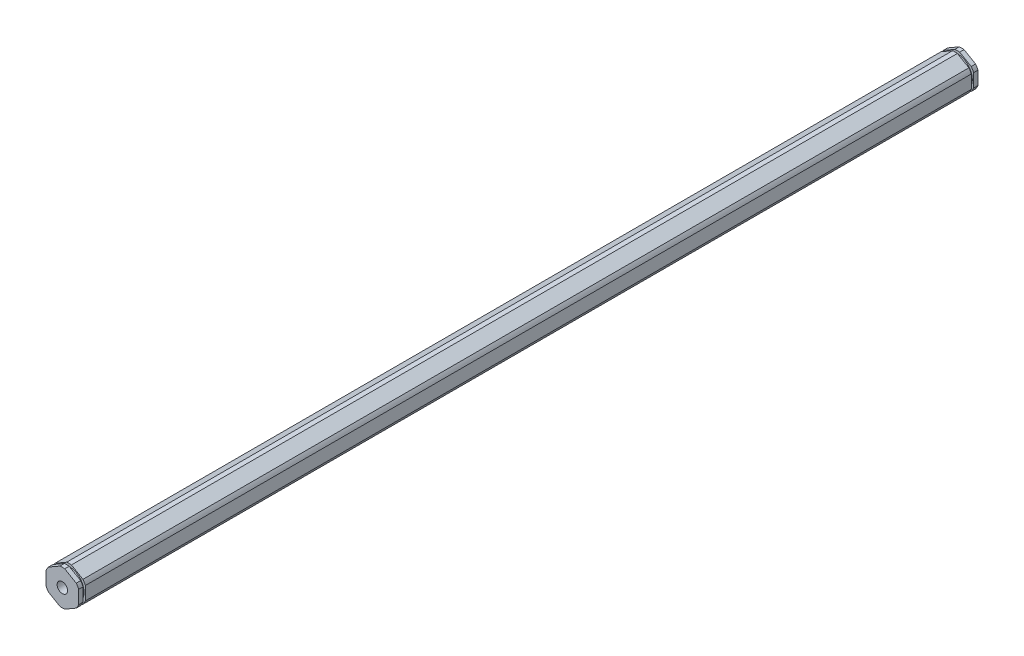
from build123d import *

# Parameters (mm, degrees)
BOSS_EXTRUDE1_DEPTH                  = 174.84725
F_10_32_TAPPED_HOLE1_D               = 4.0386
F_10_32_TAPPED_HOLE1_DEPTH           = 16.34744
F_10_32_TAPPED_HOLE1_TIP             = 1.213317848
F_10_32_TAPPED_HOLE1_ON_FACE_2_D     = 4.0386
F_10_32_TAPPED_HOLE1_ON_FACE_2_DEPTH = 16.34744
F_10_32_TAPPED_HOLE1_ON_FACE_2_TIP   = 1.213317848
SKETCH3_W                            = 0.889
SKETCH3_H                            = 1.0033


with BuildPart() as part:
    # Sketch1 → Boss-Extrude1 (new, symmetric)
    with BuildSketch(Plane.XY):
        with BuildLine():
            ThreePointArc((0.93173274, 6.79441227), (0, 6.858), (-0.93173274, 6.79441227))
            Line((-0.93173274, 6.79441227), (-5.41826726, 4.204110358))
            ThreePointArc((-5.41826726, 4.204110358), (-5.939202219, 3.429), (-6.35, 2.590301913))
            Line((-6.35, 2.590301913), (-6.35, -2.590301913))
            ThreePointArc((-6.35, -2.590301913), (-5.939202219, -3.429), (-5.41826726, -4.204110358))
            Line((-5.41826726, -4.204110358), (-0.93173274, -6.79441227))
            ThreePointArc((-0.93173274, -6.79441227), (0, -6.858), (0.93173274, -6.79441227))
            Line((0.93173274, -6.79441227), (5.41826726, -4.204110358))
            ThreePointArc((5.41826726, -4.204110358), (5.939202219, -3.429), (6.35, -2.590301913))
            Line((6.35, -2.590301913), (6.35, 2.590301913))
            ThreePointArc((6.35, 2.590301913), (5.939202219, 3.429), (5.41826726, 4.204110358))
            Line((5.41826726, 4.204110358), (0.93173274, 6.79441227))
        make_face()
    extrude(amount=BOSS_EXTRUDE1_DEPTH, both=True)

    # #10-32 Tapped Hole1
    with Locations(Plane.XY.offset(174.84725)):
        with Locations((0, 0)):
            Hole(F_10_32_TAPPED_HOLE1_D / 2, depth=F_10_32_TAPPED_HOLE1_DEPTH)
            with Locations((0, 0, -(F_10_32_TAPPED_HOLE1_DEPTH + F_10_32_TAPPED_HOLE1_TIP / 2))):  # 118° drill point
                Cone(0, F_10_32_TAPPED_HOLE1_D / 2, F_10_32_TAPPED_HOLE1_TIP, mode=Mode.SUBTRACT)

    # #10-32 Tapped Hole1 on face 2
    with Locations(Plane(origin=(0, 0, -174.84725), x_dir=(-1, 0, 0), z_dir=(0, 0, -1))):
        with Locations((0, 0)):
            Hole(F_10_32_TAPPED_HOLE1_ON_FACE_2_D / 2, depth=F_10_32_TAPPED_HOLE1_ON_FACE_2_DEPTH)
            with Locations((0, 0, -(F_10_32_TAPPED_HOLE1_ON_FACE_2_DEPTH + F_10_32_TAPPED_HOLE1_ON_FACE_2_TIP / 2))):  # 118° drill point
                Cone(0, F_10_32_TAPPED_HOLE1_ON_FACE_2_D / 2, F_10_32_TAPPED_HOLE1_ON_FACE_2_TIP, mode=Mode.SUBTRACT)

    # Sketch3 → Cut-Revolve1 (revolve, cut)
    with BuildSketch(Plane(origin=(0, 0, 0), x_dir=(0, 0, -1), z_dir=(1, 0, 0)), mode=Mode.PRIVATE) as cut_revolve1_sk:
        with Locations((-172.68825, 6.35635)):
            Rectangle(SKETCH3_W, SKETCH3_H)
    cut_revolve1 = revolve(cut_revolve1_sk.sketch.rotate(Axis((0, 0, 175.157387885), (0, 0, -1)), 90), axis=Axis((0, 0, 175.157387885), (0, 0, -1)), mode=Mode.SUBTRACT)

    # Mirror1: Cut-Revolve1 across plane
    add(cut_revolve1.mirror(Plane.XY), mode=Mode.SUBTRACT)


solid = part.part
